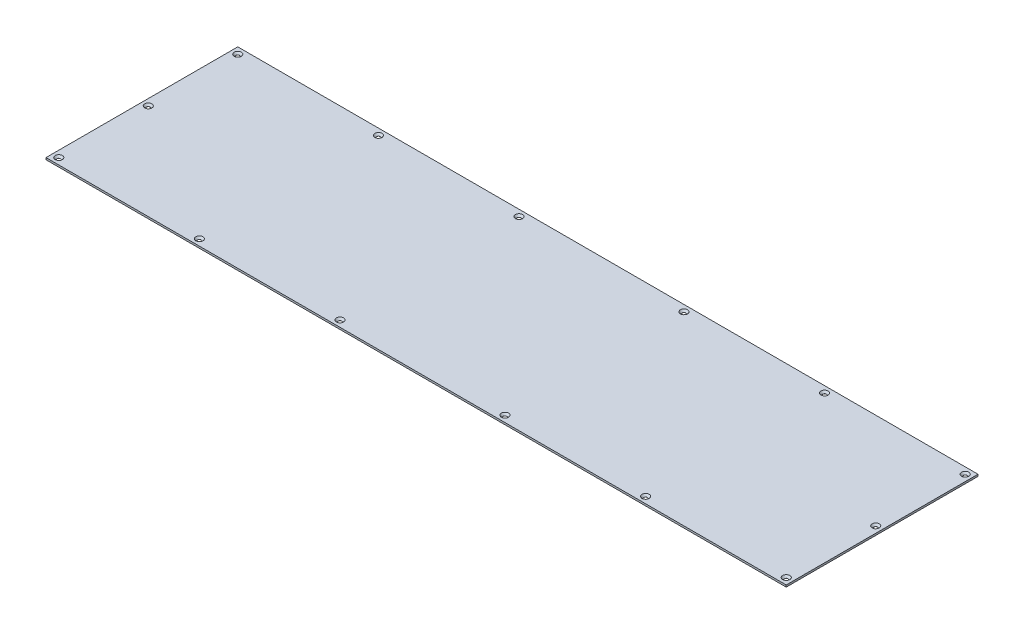
from build123d import *

# Parameters (mm, degrees)
SKETCH1_W           = 1158
SKETCH1_H           = 300
BOSS_EXTRUDE1_DEPTH = 3
HOLE3_AT_2_COUNT    = 2
HOLE3_AT_2_PITCH    = 140
HOLE3_AT_3_COUNT    = 2
HOLE3_AT_3_PITCH    = 280
HOLE3_AT_4_COUNT    = 2
HOLE3_AT_4_PITCH    = 356.089876295
HOLE3_AT_5_COUNT    = 2
HOLE3_AT_5_PITCH    = 220
HOLE3_AT_6_COUNT    = 2
HOLE3_AT_6_PITCH    = 440
HOLE3_AT_7_COUNT    = 2
HOLE3_AT_7_PITCH    = 521.536192416
HOLE3_AT_8_COUNT    = 2
HOLE3_AT_8_PITCH    = 752.066486423
HOLE3_AT_9_COUNT    = 2
HOLE3_AT_9_PITCH    = 698
HOLE3_AT_10_COUNT   = 2
HOLE3_AT_10_PITCH   = 918
HOLE3_AT_11_COUNT   = 2
HOLE3_AT_11_PITCH   = 959.752051313
HOLE3_AT_12_COUNT   = 2
HOLE3_AT_12_PITCH   = 1171.940271516
HOLE3_AT_13_COUNT   = 2
HOLE3_AT_13_PITCH   = 1138
HOLE3_AT_14_COUNT   = 2
HOLE3_AT_14_PITCH   = 1146.579260235


with BuildPart() as part:
    # Sketch1 → Boss-Extrude1 (new body)
    with BuildSketch(Plane(origin=(0, 0, 0), x_dir=(1, 0, 0), z_dir=(0, 1, 0))):
        Rectangle(SKETCH1_W, SKETCH1_H)
    extrude(amount=BOSS_EXTRUDE1_DEPTH)

    # Sketch13 → Hole3 (revolve, cut)
    with BuildSketch(Plane(origin=(-569, 3, 140), x_dir=(0, 0, 1), z_dir=(1, 0, 0))):
        Polygon((0, 0), (0, 4.652366702), (2.75, 3), (2.75, 2.85), (5.6, 0), align=None)
    hole3 = revolve(axis=Axis((-569, 17.308894879, 140), (0, -1, 0)), mode=Mode.SUBTRACT)

    # Hole3 at 2: Hole3 ×2
    with Locations(*[(0, 0, -i * HOLE3_AT_2_PITCH) for i in range(1, HOLE3_AT_2_COUNT)]):
        add(hole3, mode=Mode.SUBTRACT)

    # Hole3 at 3: Hole3 ×2
    with Locations(*[(0, 0, -i * HOLE3_AT_3_PITCH) for i in range(1, HOLE3_AT_3_COUNT)]):
        add(hole3, mode=Mode.SUBTRACT)

    # Hole3 at 4: Hole3 ×2
    with Locations(*[Vector(0.6178215519319037, 0, -0.7863183388224225) * (i * HOLE3_AT_4_PITCH) for i in range(1, HOLE3_AT_4_COUNT)]):
        add(hole3, mode=Mode.SUBTRACT)

    # Hole3 at 5: Hole3 ×2
    with Locations(*[(i * HOLE3_AT_5_PITCH, 0, 0) for i in range(1, HOLE3_AT_5_COUNT)]):
        add(hole3, mode=Mode.SUBTRACT)

    # Hole3 at 6: Hole3 ×2
    with Locations(*[(i * HOLE3_AT_6_PITCH, 0, 0) for i in range(1, HOLE3_AT_6_COUNT)]):
        add(hole3, mode=Mode.SUBTRACT)

    # Hole3 at 7: Hole3 ×2
    with Locations(*[Vector(0.8436614877321076, 0, -0.5368754921931591) * (i * HOLE3_AT_7_PITCH) for i in range(1, HOLE3_AT_7_COUNT)]):
        add(hole3, mode=Mode.SUBTRACT)

    # Hole3 at 8: Hole3 ×2
    with Locations(*[Vector(0.9281094326117898, 0, -0.3723075087840988) * (i * HOLE3_AT_8_PITCH) for i in range(1, HOLE3_AT_8_COUNT)]):
        add(hole3, mode=Mode.SUBTRACT)

    # Hole3 at 9: Hole3 ×2
    with Locations(*[(i * HOLE3_AT_9_PITCH, 0, 0) for i in range(1, HOLE3_AT_9_COUNT)]):
        add(hole3, mode=Mode.SUBTRACT)

    # Hole3 at 10: Hole3 ×2
    with Locations(*[(i * HOLE3_AT_10_PITCH, 0, 0) for i in range(1, HOLE3_AT_10_COUNT)]):
        add(hole3, mode=Mode.SUBTRACT)

    # Hole3 at 11: Hole3 ×2
    with Locations(*[Vector(0.9564970439436685, 0, -0.2917420177605959) * (i * HOLE3_AT_11_PITCH) for i in range(1, HOLE3_AT_11_COUNT)]):
        add(hole3, mode=Mode.SUBTRACT)

    # Hole3 at 12: Hole3 ×2
    with Locations(*[Vector(0.9710392480397633, 0, -0.2389200258797307) * (i * HOLE3_AT_12_PITCH) for i in range(1, HOLE3_AT_12_COUNT)]):
        add(hole3, mode=Mode.SUBTRACT)

    # Hole3 at 13: Hole3 ×2
    with Locations(*[(i * HOLE3_AT_13_PITCH, 0, 0) for i in range(1, HOLE3_AT_13_COUNT)]):
        add(hole3, mode=Mode.SUBTRACT)

    # Hole3 at 14: Hole3 ×2
    with Locations(*[Vector(0.9925175166409417, 0, -0.1221023306939646) * (i * HOLE3_AT_14_PITCH) for i in range(1, HOLE3_AT_14_COUNT)]):
        add(hole3, mode=Mode.SUBTRACT)


solid = part.part
